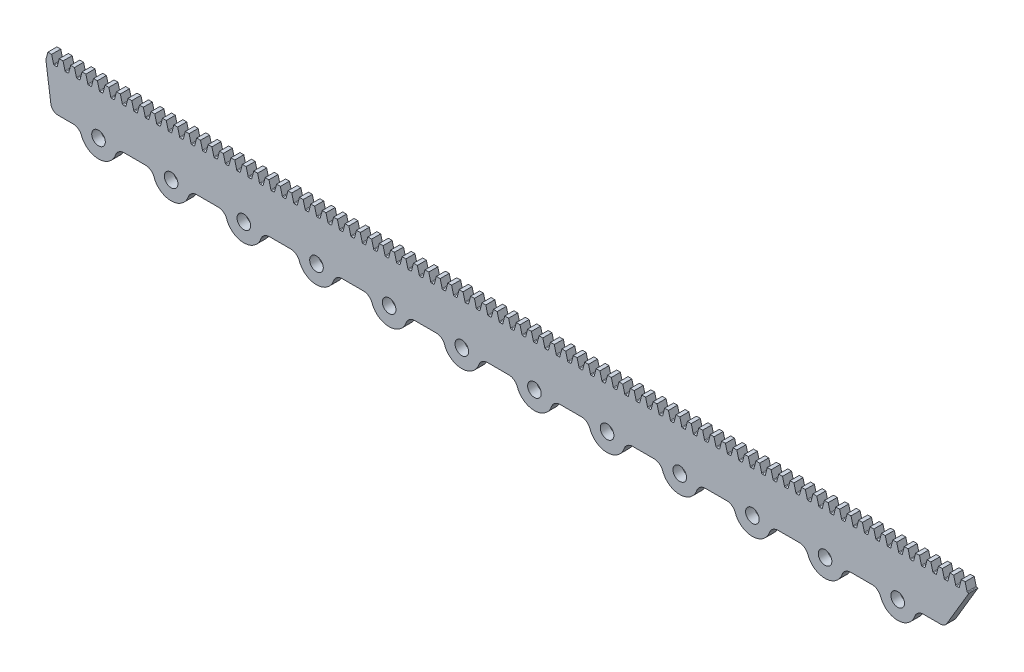
from build123d import *

# Parameters (mm, degrees)
SKETCH1_R           = 2.38125
BOSS_EXTRUDE3_DEPTH = 3.175


with BuildPart() as part:
    # Sketch1 → Boss-Extrude3 (new body)
    with BuildSketch(Plane.XY):
        with BuildLine():
            Line((-103.492449052, -0.977438527), (-95.755744081, 12.0777))
            Line((-95.755744081, 12.0777), (-96.149260964, 12.0777))
            ThreePointArc((-96.149260964, 12.0777), (-96.304764153, 12.130864848), (-96.395170465, 12.268103479))
            Line((-96.395170465, 12.268103479), (-97.081644081, 14.9225))
            Line((-97.081644081, 14.9225), (-98.419666752, 14.9225))
            Line((-98.419666752, 14.9225), (-99.106140368, 12.268103479))
            ThreePointArc((-99.106140368, 12.268103479), (-99.19654668, 12.130864848), (-99.352049869, 12.0777))
            Line((-99.352049869, 12.0777), (-100.139083634, 12.0777))
            ThreePointArc((-100.139083634, 12.0777), (-100.294586823, 12.130864848), (-100.384993135, 12.268103479))
            Line((-100.384993135, 12.268103479), (-101.071466751, 14.9225))
            Line((-101.071466751, 14.9225), (-102.409489422, 14.9225))
            Line((-102.409489422, 14.9225), (-103.095963038, 12.268103479))
            ThreePointArc((-103.095963038, 12.268103479), (-103.18636935, 12.130864848), (-103.341872539, 12.0777))
            Line((-103.341872539, 12.0777), (-104.128906304, 12.0777))
            ThreePointArc((-104.128906304, 12.0777), (-104.284409493, 12.130864848), (-104.374815805, 12.268103479))
            Line((-104.374815805, 12.268103479), (-105.061289421, 14.9225))
            Line((-105.061289421, 14.9225), (-106.399312092, 14.9225))
            Line((-106.399312092, 14.9225), (-107.085785708, 12.268103479))
            ThreePointArc((-107.085785708, 12.268103479), (-107.17619202, 12.130864848), (-107.331695209, 12.0777))
            Line((-107.331695209, 12.0777), (-108.118728974, 12.0777))
            ThreePointArc((-108.118728974, 12.0777), (-108.274232164, 12.130864848), (-108.364638475, 12.268103479))
            Line((-108.364638475, 12.268103479), (-109.051112091, 14.9225))
            Line((-109.051112091, 14.9225), (-110.389134762, 14.9225))
            Line((-110.389134762, 14.9225), (-111.075608378, 12.268103479))
            ThreePointArc((-111.075608378, 12.268103479), (-111.16601469, 12.130864848), (-111.321517879, 12.0777))
            Line((-111.321517879, 12.0777), (-112.108551644, 12.0777))
            ThreePointArc((-112.108551644, 12.0777), (-112.264054834, 12.130864848), (-112.354461145, 12.268103479))
            Line((-112.354461145, 12.268103479), (-113.040934761, 14.9225))
            Line((-113.040934761, 14.9225), (-114.378957432, 14.9225))
            Line((-114.378957432, 14.9225), (-115.065431048, 12.268103479))
            ThreePointArc((-115.065431048, 12.268103479), (-115.15583736, 12.130864848), (-115.311340549, 12.0777))
            Line((-115.311340549, 12.0777), (-116.098374315, 12.0777))
            ThreePointArc((-116.098374315, 12.0777), (-116.253877504, 12.130864848), (-116.344283815, 12.268103479))
            Line((-116.344283815, 12.268103479), (-117.030757431, 14.9225))
            Line((-117.030757431, 14.9225), (-118.368780102, 14.9225))
            Line((-118.368780102, 14.9225), (-119.055253718, 12.268103479))
            ThreePointArc((-119.055253718, 12.268103479), (-119.14566003, 12.130864848), (-119.301163219, 12.0777))
            Line((-119.301163219, 12.0777), (-120.088196985, 12.0777))
            ThreePointArc((-120.088196985, 12.0777), (-120.243700174, 12.130864848), (-120.334106485, 12.268103479))
            Line((-120.334106485, 12.268103479), (-121.020580101, 14.9225))
            Line((-121.020580101, 14.9225), (-122.358602772, 14.9225))
            Line((-122.358602772, 14.9225), (-123.045076388, 12.268103479))
            ThreePointArc((-123.045076388, 12.268103479), (-123.1354827, 12.130864848), (-123.290985889, 12.0777))
            Line((-123.290985889, 12.0777), (-124.078019655, 12.0777))
            ThreePointArc((-124.078019655, 12.0777), (-124.233522844, 12.130864848), (-124.323929155, 12.268103479))
            Line((-124.323929155, 12.268103479), (-125.010402771, 14.9225))
            Line((-125.010402771, 14.9225), (-126.348425442, 14.9225))
            Line((-126.348425442, 14.9225), (-127.034899058, 12.268103479))
            ThreePointArc((-127.034899058, 12.268103479), (-127.12530537, 12.130864848), (-127.280808559, 12.0777))
            Line((-127.280808559, 12.0777), (-128.067842325, 12.0777))
            ThreePointArc((-128.067842325, 12.0777), (-128.223345514, 12.130864848), (-128.313751825, 12.268103479))
            Line((-128.313751825, 12.268103479), (-129.000225442, 14.9225))
            Line((-129.000225442, 14.9225), (-130.338248112, 14.9225))
            Line((-130.338248112, 14.9225), (-131.024721728, 12.268103479))
            ThreePointArc((-131.024721728, 12.268103479), (-131.11512804, 12.130864848), (-131.270631229, 12.0777))
            Line((-131.270631229, 12.0777), (-132.057664995, 12.0777))
            ThreePointArc((-132.057664995, 12.0777), (-132.213168184, 12.130864848), (-132.303574495, 12.268103479))
            Line((-132.303574495, 12.268103479), (-132.990048112, 14.9225))
            Line((-132.990048112, 14.9225), (-134.328070782, 14.9225))
            Line((-134.328070782, 14.9225), (-135.014544399, 12.268103479))
            ThreePointArc((-135.014544399, 12.268103479), (-135.10495071, 12.130864848), (-135.260453899, 12.0777))
            Line((-135.260453899, 12.0777), (-136.047487665, 12.0777))
            ThreePointArc((-136.047487665, 12.0777), (-136.202990854, 12.130864848), (-136.293397165, 12.268103479))
            Line((-136.293397165, 12.268103479), (-136.979870782, 14.9225))
            Line((-136.979870782, 14.9225), (-138.317893452, 14.9225))
            Line((-138.317893452, 14.9225), (-139.004367069, 12.268103479))
            ThreePointArc((-139.004367069, 12.268103479), (-139.09477338, 12.130864848), (-139.250276569, 12.0777))
            Line((-139.250276569, 12.0777), (-140.037310335, 12.0777))
            ThreePointArc((-140.037310335, 12.0777), (-140.192813524, 12.130864848), (-140.283219836, 12.268103479))
            Line((-140.283219836, 12.268103479), (-140.969693452, 14.9225))
            Line((-140.969693452, 14.9225), (-142.307716122, 14.9225))
            Line((-142.307716122, 14.9225), (-142.994189739, 12.268103479))
            ThreePointArc((-142.994189739, 12.268103479), (-143.08459605, 12.130864848), (-143.240099239, 12.0777))
            Line((-143.240099239, 12.0777), (-144.027133005, 12.0777))
            ThreePointArc((-144.027133005, 12.0777), (-144.182636194, 12.130864848), (-144.273042506, 12.268103479))
            Line((-144.273042506, 12.268103479), (-144.959516122, 14.9225))
            Line((-144.959516122, 14.9225), (-146.297538793, 14.9225))
            Line((-146.297538793, 14.9225), (-146.984012409, 12.268103479))
            ThreePointArc((-146.984012409, 12.268103479), (-147.07441872, 12.130864848), (-147.229921909, 12.0777))
            Line((-147.229921909, 12.0777), (-148.016955675, 12.0777))
            ThreePointArc((-148.016955675, 12.0777), (-148.172458864, 12.130864848), (-148.262865176, 12.268103479))
            Line((-148.262865176, 12.268103479), (-148.949338792, 14.9225))
            Line((-148.949338792, 14.9225), (-150.287361463, 14.9225))
            Line((-150.287361463, 14.9225), (-150.973835079, 12.268103479))
            ThreePointArc((-150.973835079, 12.268103479), (-151.06424139, 12.130864848), (-151.219744579, 12.0777))
            Line((-151.219744579, 12.0777), (-152.006778345, 12.0777))
            ThreePointArc((-152.006778345, 12.0777), (-152.162281534, 12.130864848), (-152.252687846, 12.268103479))
            Line((-152.252687846, 12.268103479), (-152.939161462, 14.9225))
            Line((-152.939161462, 14.9225), (-154.277184133, 14.9225))
            Line((-154.277184133, 14.9225), (-154.963657749, 12.268103479))
            ThreePointArc((-154.963657749, 12.268103479), (-155.05406406, 12.130864848), (-155.20956725, 12.0777))
            Line((-155.20956725, 12.0777), (-155.996601015, 12.0777))
            ThreePointArc((-155.996601015, 12.0777), (-156.152104204, 12.130864848), (-156.242510516, 12.268103479))
            Line((-156.242510516, 12.268103479), (-156.928984132, 14.9225))
            Line((-156.928984132, 14.9225), (-158.267006803, 14.9225))
            Line((-158.267006803, 14.9225), (-158.953480419, 12.268103479))
            ThreePointArc((-158.953480419, 12.268103479), (-159.04388673, 12.130864848), (-159.19938992, 12.0777))
            Line((-159.19938992, 12.0777), (-159.986423685, 12.0777))
            ThreePointArc((-159.986423685, 12.0777), (-160.141926874, 12.130864848), (-160.232333186, 12.268103479))
            Line((-160.232333186, 12.268103479), (-160.918806802, 14.9225))
            Line((-160.918806802, 14.9225), (-162.256829473, 14.9225))
            Line((-162.256829473, 14.9225), (-162.943303089, 12.268103479))
            ThreePointArc((-162.943303089, 12.268103479), (-163.0337094, 12.130864848), (-163.18921259, 12.0777))
            Line((-163.18921259, 12.0777), (-163.976246355, 12.0777))
            ThreePointArc((-163.976246355, 12.0777), (-164.131749544, 12.130864848), (-164.222155856, 12.268103479))
            Line((-164.222155856, 12.268103479), (-164.908629472, 14.9225))
            Line((-164.908629472, 14.9225), (-166.246652143, 14.9225))
            Line((-166.246652143, 14.9225), (-166.933125759, 12.268103479))
            ThreePointArc((-166.933125759, 12.268103479), (-167.023532071, 12.130864848), (-167.17903526, 12.0777))
            Line((-167.17903526, 12.0777), (-167.966069025, 12.0777))
            ThreePointArc((-167.966069025, 12.0777), (-168.121572214, 12.130864848), (-168.211978526, 12.268103479))
            Line((-168.211978526, 12.268103479), (-168.898452142, 14.9225))
            Line((-168.898452142, 14.9225), (-170.236474813, 14.9225))
            Line((-170.236474813, 14.9225), (-170.922948429, 12.268103479))
            ThreePointArc((-170.922948429, 12.268103479), (-171.013354741, 12.130864848), (-171.16885793, 12.0777))
            Line((-171.16885793, 12.0777), (-171.955891695, 12.0777))
            ThreePointArc((-171.955891695, 12.0777), (-172.111394884, 12.130864848), (-172.201801196, 12.268103479))
            Line((-172.201801196, 12.268103479), (-172.888274812, 14.9225))
            Line((-172.888274812, 14.9225), (-174.226297483, 14.9225))
            Line((-174.226297483, 14.9225), (-174.912771099, 12.268103479))
            ThreePointArc((-174.912771099, 12.268103479), (-175.003177411, 12.130864848), (-175.1586806, 12.0777))
            Line((-175.1586806, 12.0777), (-175.945714365, 12.0777))
            ThreePointArc((-175.945714365, 12.0777), (-176.101217555, 12.130864848), (-176.191623866, 12.268103479))
            Line((-176.191623866, 12.268103479), (-176.878097482, 14.9225))
            Line((-176.878097482, 14.9225), (-178.216120153, 14.9225))
            Line((-178.216120153, 14.9225), (-178.902593769, 12.268103479))
            ThreePointArc((-178.902593769, 12.268103479), (-178.993000081, 12.130864848), (-179.14850327, 12.0777))
            Line((-179.14850327, 12.0777), (-179.935537035, 12.0777))
            ThreePointArc((-179.935537035, 12.0777), (-180.091040225, 12.130864848), (-180.181446536, 12.268103479))
            Line((-180.181446536, 12.268103479), (-180.867920152, 14.9225))
            Line((-180.867920152, 14.9225), (-182.205942823, 14.9225))
            Line((-182.205942823, 14.9225), (-182.892416439, 12.268103479))
            ThreePointArc((-182.892416439, 12.268103479), (-182.982822751, 12.130864848), (-183.13832594, 12.0777))
            Line((-183.13832594, 12.0777), (-183.925359706, 12.0777))
            ThreePointArc((-183.925359706, 12.0777), (-184.080862895, 12.130864848), (-184.171269206, 12.268103479))
            Line((-184.171269206, 12.268103479), (-184.857742822, 14.9225))
            Line((-184.857742822, 14.9225), (-186.195765493, 14.9225))
            Line((-186.195765493, 14.9225), (-186.882239109, 12.268103479))
            ThreePointArc((-186.882239109, 12.268103479), (-186.972645421, 12.130864848), (-187.12814861, 12.0777))
            Line((-187.12814861, 12.0777), (-187.915182376, 12.0777))
            ThreePointArc((-187.915182376, 12.0777), (-188.070685565, 12.130864848), (-188.161091876, 12.268103479))
            Line((-188.161091876, 12.268103479), (-188.847565492, 14.9225))
            Line((-188.847565492, 14.9225), (-190.185588163, 14.9225))
            Line((-190.185588163, 14.9225), (-190.872061779, 12.268103479))
            ThreePointArc((-190.872061779, 12.268103479), (-190.962468091, 12.130864848), (-191.11797128, 12.0777))
            Line((-191.11797128, 12.0777), (-191.905005046, 12.0777))
            ThreePointArc((-191.905005046, 12.0777), (-192.060508235, 12.130864848), (-192.150914546, 12.268103479))
            Line((-192.150914546, 12.268103479), (-192.837388162, 14.9225))
            Line((-192.837388162, 14.9225), (-194.175410833, 14.9225))
            Line((-194.175410833, 14.9225), (-194.861884449, 12.268103479))
            ThreePointArc((-194.861884449, 12.268103479), (-194.952290761, 12.130864848), (-195.10779395, 12.0777))
            Line((-195.10779395, 12.0777), (-195.894827716, 12.0777))
            ThreePointArc((-195.894827716, 12.0777), (-196.050330905, 12.130864848), (-196.140737216, 12.268103479))
            Line((-196.140737216, 12.268103479), (-196.827210833, 14.9225))
            Line((-196.827210833, 14.9225), (-198.165233503, 14.9225))
            Line((-198.165233503, 14.9225), (-198.851707119, 12.268103479))
            ThreePointArc((-198.851707119, 12.268103479), (-198.942113431, 12.130864848), (-199.09761662, 12.0777))
            Line((-199.09761662, 12.0777), (-199.884650386, 12.0777))
            ThreePointArc((-199.884650386, 12.0777), (-200.040153575, 12.130864848), (-200.130559886, 12.268103479))
            Line((-200.130559886, 12.268103479), (-200.817033503, 14.9225))
            Line((-200.817033503, 14.9225), (-202.155056173, 14.9225))
            Line((-202.155056173, 14.9225), (-202.84152979, 12.268103479))
            ThreePointArc((-202.84152979, 12.268103479), (-202.931936101, 12.130864848), (-203.08743929, 12.0777))
            Line((-203.08743929, 12.0777), (-203.874473056, 12.0777))
            ThreePointArc((-203.874473056, 12.0777), (-204.029976245, 12.130864848), (-204.120382556, 12.268103479))
            Line((-204.120382556, 12.268103479), (-204.806856173, 14.9225))
            Line((-204.806856173, 14.9225), (-206.144878843, 14.9225))
            Line((-206.144878843, 14.9225), (-206.83135246, 12.268103479))
            ThreePointArc((-206.83135246, 12.268103479), (-206.921758771, 12.130864848), (-207.07726196, 12.0777))
            Line((-207.07726196, 12.0777), (-207.864295726, 12.0777))
            ThreePointArc((-207.864295726, 12.0777), (-208.019798915, 12.130864848), (-208.110205227, 12.268103479))
            Line((-208.110205227, 12.268103479), (-208.796678843, 14.9225))
            Line((-208.796678843, 14.9225), (-210.134701513, 14.9225))
            Line((-210.134701513, 14.9225), (-210.82117513, 12.268103479))
            ThreePointArc((-210.82117513, 12.268103479), (-210.911581441, 12.130864848), (-211.06708463, 12.0777))
            Line((-211.06708463, 12.0777), (-211.854118396, 12.0777))
            ThreePointArc((-211.854118396, 12.0777), (-212.009621585, 12.130864848), (-212.100027897, 12.268103479))
            Line((-212.100027897, 12.268103479), (-212.786501513, 14.9225))
            Line((-212.786501513, 14.9225), (-214.124524184, 14.9225))
            Line((-214.124524184, 14.9225), (-214.8109978, 12.268103479))
            ThreePointArc((-214.8109978, 12.268103479), (-214.901404111, 12.130864848), (-215.0569073, 12.0777))
            Line((-215.0569073, 12.0777), (-215.843941066, 12.0777))
            ThreePointArc((-215.843941066, 12.0777), (-215.999444255, 12.130864848), (-216.089850567, 12.268103479))
            Line((-216.089850567, 12.268103479), (-216.776324183, 14.9225))
            Line((-216.776324183, 14.9225), (-218.114346854, 14.9225))
            Line((-218.114346854, 14.9225), (-218.80082047, 12.268103479))
            ThreePointArc((-218.80082047, 12.268103479), (-218.891226781, 12.130864848), (-219.04672997, 12.0777))
            Line((-219.04672997, 12.0777), (-219.833763736, 12.0777))
            ThreePointArc((-219.833763736, 12.0777), (-219.989266925, 12.130864848), (-220.079673237, 12.268103479))
            Line((-220.079673237, 12.268103479), (-220.766146853, 14.9225))
            Line((-220.766146853, 14.9225), (-222.104169524, 14.9225))
            Line((-222.104169524, 14.9225), (-222.79064314, 12.268103479))
            ThreePointArc((-222.79064314, 12.268103479), (-222.881049451, 12.130864848), (-223.036552641, 12.0777))
            Line((-223.036552641, 12.0777), (-223.823586406, 12.0777))
            ThreePointArc((-223.823586406, 12.0777), (-223.979089595, 12.130864848), (-224.069495907, 12.268103479))
            Line((-224.069495907, 12.268103479), (-224.755969523, 14.9225))
            Line((-224.755969523, 14.9225), (-226.093992194, 14.9225))
            Line((-226.093992194, 14.9225), (-226.78046581, 12.268103479))
            ThreePointArc((-226.78046581, 12.268103479), (-226.870872121, 12.130864848), (-227.026375311, 12.0777))
            Line((-227.026375311, 12.0777), (-227.813409076, 12.0777))
            ThreePointArc((-227.813409076, 12.0777), (-227.968912265, 12.130864848), (-228.059318577, 12.268103479))
            Line((-228.059318577, 12.268103479), (-228.745792193, 14.9225))
            Line((-228.745792193, 14.9225), (-230.083814864, 14.9225))
            Line((-230.083814864, 14.9225), (-230.77028848, 12.268103479))
            ThreePointArc((-230.77028848, 12.268103479), (-230.860694791, 12.130864848), (-231.016197981, 12.0777))
            Line((-231.016197981, 12.0777), (-231.803231746, 12.0777))
            ThreePointArc((-231.803231746, 12.0777), (-231.958734935, 12.130864848), (-232.049141247, 12.268103479))
            Line((-232.049141247, 12.268103479), (-232.735614863, 14.9225))
            Line((-232.735614863, 14.9225), (-234.073637534, 14.9225))
            Line((-234.073637534, 14.9225), (-234.76011115, 12.268103479))
            ThreePointArc((-234.76011115, 12.268103479), (-234.850517462, 12.130864848), (-235.006020651, 12.0777))
            Line((-235.006020651, 12.0777), (-235.793054416, 12.0777))
            ThreePointArc((-235.793054416, 12.0777), (-235.948557605, 12.130864848), (-236.038963917, 12.268103479))
            Line((-236.038963917, 12.268103479), (-236.725437533, 14.9225))
            Line((-236.725437533, 14.9225), (-238.063460204, 14.9225))
            Line((-238.063460204, 14.9225), (-238.74993382, 12.268103479))
            ThreePointArc((-238.74993382, 12.268103479), (-238.840340132, 12.130864848), (-238.995843321, 12.0777))
            Line((-238.995843321, 12.0777), (-239.782877086, 12.0777))
            ThreePointArc((-239.782877086, 12.0777), (-239.938380275, 12.130864848), (-240.028786587, 12.268103479))
            Line((-240.028786587, 12.268103479), (-240.715260203, 14.9225))
            Line((-240.715260203, 14.9225), (-242.053282874, 14.9225))
            Line((-242.053282874, 14.9225), (-242.73975649, 12.268103479))
            ThreePointArc((-242.73975649, 12.268103479), (-242.830162802, 12.130864848), (-242.985665991, 12.0777))
            Line((-242.985665991, 12.0777), (-243.772699756, 12.0777))
            ThreePointArc((-243.772699756, 12.0777), (-243.928202946, 12.130864848), (-244.018609257, 12.268103479))
            Line((-244.018609257, 12.268103479), (-244.705082873, 14.9225))
            Line((-244.705082873, 14.9225), (-246.043105544, 14.9225))
            Line((-246.043105544, 14.9225), (-246.72957916, 12.268103479))
            ThreePointArc((-246.72957916, 12.268103479), (-246.819985472, 12.130864848), (-246.975488661, 12.0777))
            Line((-246.975488661, 12.0777), (-247.762522426, 12.0777))
            ThreePointArc((-247.762522426, 12.0777), (-247.918025616, 12.130864848), (-248.008431927, 12.268103479))
            Line((-248.008431927, 12.268103479), (-248.694905543, 14.9225))
            Line((-248.694905543, 14.9225), (-250.032928214, 14.9225))
            Line((-250.032928214, 14.9225), (-250.71940183, 12.268103479))
            ThreePointArc((-250.71940183, 12.268103479), (-250.809808142, 12.130864848), (-250.965311331, 12.0777))
            Line((-250.965311331, 12.0777), (-251.752345097, 12.0777))
            ThreePointArc((-251.752345097, 12.0777), (-251.907848286, 12.130864848), (-251.998254597, 12.268103479))
            Line((-251.998254597, 12.268103479), (-252.684728213, 14.9225))
            Line((-252.684728213, 14.9225), (-254.022750884, 14.9225))
            Line((-254.022750884, 14.9225), (-254.7092245, 12.268103479))
            ThreePointArc((-254.7092245, 12.268103479), (-254.799630812, 12.130864848), (-254.955134001, 12.0777))
            Line((-254.955134001, 12.0777), (-255.742167767, 12.0777))
            ThreePointArc((-255.742167767, 12.0777), (-255.897670956, 12.130864848), (-255.988077267, 12.268103479))
            Line((-255.988077267, 12.268103479), (-256.674550883, 14.9225))
            Line((-256.674550883, 14.9225), (-258.012573554, 14.9225))
            Line((-258.012573554, 14.9225), (-258.69904717, 12.268103479))
            ThreePointArc((-258.69904717, 12.268103479), (-258.789453482, 12.130864848), (-258.944956671, 12.0777))
            Line((-258.944956671, 12.0777), (-259.731990437, 12.0777))
            ThreePointArc((-259.731990437, 12.0777), (-259.887493626, 12.130864848), (-259.977899937, 12.268103479))
            Line((-259.977899937, 12.268103479), (-260.664373553, 14.9225))
            Line((-260.664373553, 14.9225), (-262.002396224, 14.9225))
            Line((-262.002396224, 14.9225), (-262.68886984, 12.268103479))
            ThreePointArc((-262.68886984, 12.268103479), (-262.779276152, 12.130864848), (-262.934779341, 12.0777))
            Line((-262.934779341, 12.0777), (-263.721813107, 12.0777))
            ThreePointArc((-263.721813107, 12.0777), (-263.877316296, 12.130864848), (-263.967722607, 12.268103479))
            Line((-263.967722607, 12.268103479), (-264.654196224, 14.9225))
            Line((-264.654196224, 14.9225), (-265.992218894, 14.9225))
            Line((-265.992218894, 14.9225), (-266.67869251, 12.268103479))
            ThreePointArc((-266.67869251, 12.268103479), (-266.769098822, 12.130864848), (-266.924602011, 12.0777))
            Line((-266.924602011, 12.0777), (-267.711635777, 12.0777))
            ThreePointArc((-267.711635777, 12.0777), (-267.867138966, 12.130864848), (-267.957545277, 12.268103479))
            Line((-267.957545277, 12.268103479), (-268.644018894, 14.9225))
            Line((-268.644018894, 14.9225), (-269.982041564, 14.9225))
            Line((-269.982041564, 14.9225), (-270.668515181, 12.268103479))
            ThreePointArc((-270.668515181, 12.268103479), (-270.758921492, 12.130864848), (-270.914424681, 12.0777))
            Line((-270.914424681, 12.0777), (-271.701458447, 12.0777))
            ThreePointArc((-271.701458447, 12.0777), (-271.856961636, 12.130864848), (-271.947367947, 12.268103479))
            Line((-271.947367947, 12.268103479), (-272.633841564, 14.9225))
            Line((-272.633841564, 14.9225), (-273.971864234, 14.9225))
            Line((-273.971864234, 14.9225), (-274.658337851, 12.268103479))
            ThreePointArc((-274.658337851, 12.268103479), (-274.748744162, 12.130864848), (-274.904247351, 12.0777))
            Line((-274.904247351, 12.0777), (-275.691281117, 12.0777))
            ThreePointArc((-275.691281117, 12.0777), (-275.846784306, 12.130864848), (-275.937190618, 12.268103479))
            Line((-275.937190618, 12.268103479), (-276.623664234, 14.9225))
            Line((-276.623664234, 14.9225), (-277.961686904, 14.9225))
            Line((-277.961686904, 14.9225), (-278.648160521, 12.268103479))
            ThreePointArc((-278.648160521, 12.268103479), (-278.738566832, 12.130864848), (-278.894070021, 12.0777))
            Line((-278.894070021, 12.0777), (-279.681103787, 12.0777))
            ThreePointArc((-279.681103787, 12.0777), (-279.836606976, 12.130864848), (-279.927013288, 12.268103479))
            Line((-279.927013288, 12.268103479), (-280.613486904, 14.9225))
            Line((-280.613486904, 14.9225), (-281.951509575, 14.9225))
            Line((-281.951509575, 14.9225), (-282.637983191, 12.268103479))
            ThreePointArc((-282.637983191, 12.268103479), (-282.728389502, 12.130864848), (-282.883892691, 12.0777))
            Line((-282.883892691, 12.0777), (-283.670926457, 12.0777))
            ThreePointArc((-283.670926457, 12.0777), (-283.826429646, 12.130864848), (-283.916835958, 12.268103479))
            Line((-283.916835958, 12.268103479), (-284.603309574, 14.9225))
            Line((-284.603309574, 14.9225), (-285.941332245, 14.9225))
            Line((-285.941332245, 14.9225), (-286.627805861, 12.268103479))
            ThreePointArc((-286.627805861, 12.268103479), (-286.718212172, 12.130864848), (-286.873715361, 12.0777))
            Line((-286.873715361, 12.0777), (-287.660749127, 12.0777))
            ThreePointArc((-287.660749127, 12.0777), (-287.816252316, 12.130864848), (-287.906658628, 12.268103479))
            Line((-287.906658628, 12.268103479), (-288.593132244, 14.9225))
            Line((-288.593132244, 14.9225), (-289.931154915, 14.9225))
            Line((-289.931154915, 14.9225), (-290.617628531, 12.268103479))
            ThreePointArc((-290.617628531, 12.268103479), (-290.708034842, 12.130864848), (-290.863538032, 12.0777))
            Line((-290.863538032, 12.0777), (-291.650571797, 12.0777))
            ThreePointArc((-291.650571797, 12.0777), (-291.806074986, 12.130864848), (-291.896481298, 12.268103479))
            Line((-291.896481298, 12.268103479), (-292.582954914, 14.9225))
            Line((-292.582954914, 14.9225), (-293.920977585, 14.9225))
            Line((-293.920977585, 14.9225), (-294.607451201, 12.268103479))
            ThreePointArc((-294.607451201, 12.268103479), (-294.697857512, 12.130864848), (-294.853360702, 12.0777))
            Line((-294.853360702, 12.0777), (-295.640394467, 12.0777))
            ThreePointArc((-295.640394467, 12.0777), (-295.795897656, 12.130864848), (-295.886303968, 12.268103479))
            Line((-295.886303968, 12.268103479), (-296.572777584, 14.9225))
            Line((-296.572777584, 14.9225), (-297.910800255, 14.9225))
            Line((-297.910800255, 14.9225), (-298.597273871, 12.268103479))
            ThreePointArc((-298.597273871, 12.268103479), (-298.687680182, 12.130864848), (-298.843183372, 12.0777))
            Line((-298.843183372, 12.0777), (-299.630217137, 12.0777))
            ThreePointArc((-299.630217137, 12.0777), (-299.785720326, 12.130864848), (-299.876126638, 12.268103479))
            Line((-299.876126638, 12.268103479), (-300.562600254, 14.9225))
            Line((-300.562600254, 14.9225), (-301.900622925, 14.9225))
            Line((-301.900622925, 14.9225), (-302.587096541, 12.268103479))
            ThreePointArc((-302.587096541, 12.268103479), (-302.677502853, 12.130864848), (-302.833006042, 12.0777))
            Line((-302.833006042, 12.0777), (-303.620039807, 12.0777))
            ThreePointArc((-303.620039807, 12.0777), (-303.775542996, 12.130864848), (-303.865949308, 12.268103479))
            Line((-303.865949308, 12.268103479), (-304.552422924, 14.9225))
            Line((-304.552422924, 14.9225), (-305.890445595, 14.9225))
            Line((-305.890445595, 14.9225), (-306.576919211, 12.268103479))
            ThreePointArc((-306.576919211, 12.268103479), (-306.667325523, 12.130864848), (-306.822828712, 12.0777))
            Line((-306.822828712, 12.0777), (-307.609862477, 12.0777))
            ThreePointArc((-307.609862477, 12.0777), (-307.765365666, 12.130864848), (-307.855771978, 12.268103479))
            Line((-307.855771978, 12.268103479), (-308.542245594, 14.9225))
            Line((-308.542245594, 14.9225), (-309.880268265, 14.9225))
            Line((-309.880268265, 14.9225), (-310.566741881, 12.268103479))
            ThreePointArc((-310.566741881, 12.268103479), (-310.657148193, 12.130864848), (-310.812651382, 12.0777))
            Line((-310.812651382, 12.0777), (-311.599685147, 12.0777))
            ThreePointArc((-311.599685147, 12.0777), (-311.755188337, 12.130864848), (-311.845594648, 12.268103479))
            Line((-311.845594648, 12.268103479), (-312.532068264, 14.9225))
            Line((-312.532068264, 14.9225), (-313.870090935, 14.9225))
            Line((-313.870090935, 14.9225), (-314.556564551, 12.268103479))
            ThreePointArc((-314.556564551, 12.268103479), (-314.646970863, 12.130864848), (-314.802474052, 12.0777))
            Line((-314.802474052, 12.0777), (-315.589507817, 12.0777))
            ThreePointArc((-315.589507817, 12.0777), (-315.745011007, 12.130864848), (-315.835417318, 12.268103479))
            Line((-315.835417318, 12.268103479), (-316.521890934, 14.9225))
            Line((-316.521890934, 14.9225), (-317.859913605, 14.9225))
            Line((-317.859913605, 14.9225), (-318.546387221, 12.268103479))
            ThreePointArc((-318.546387221, 12.268103479), (-318.636793533, 12.130864848), (-318.792296722, 12.0777))
            Line((-318.792296722, 12.0777), (-319.579330488, 12.0777))
            ThreePointArc((-319.579330488, 12.0777), (-319.734833677, 12.130864848), (-319.825239988, 12.268103479))
            Line((-319.825239988, 12.268103479), (-320.511713604, 14.9225))
            Line((-320.511713604, 14.9225), (-321.849736275, 14.9225))
            Line((-321.849736275, 14.9225), (-322.536209891, 12.268103479))
            ThreePointArc((-322.536209891, 12.268103479), (-322.626616203, 12.130864848), (-322.782119392, 12.0777))
            Line((-322.782119392, 12.0777), (-323.569153158, 12.0777))
            ThreePointArc((-323.569153158, 12.0777), (-323.724656347, 12.130864848), (-323.815062658, 12.268103479))
            Line((-323.815062658, 12.268103479), (-324.501536274, 14.9225))
            Line((-324.501536274, 14.9225), (-325.839558945, 14.9225))
            Line((-325.839558945, 14.9225), (-326.526032561, 12.268103479))
            ThreePointArc((-326.526032561, 12.268103479), (-326.616438873, 12.130864848), (-326.771942062, 12.0777))
            Line((-326.771942062, 12.0777), (-327.558975828, 12.0777))
            ThreePointArc((-327.558975828, 12.0777), (-327.714479017, 12.130864848), (-327.804885328, 12.268103479))
            Line((-327.804885328, 12.268103479), (-328.491358944, 14.9225))
            Line((-328.491358944, 14.9225), (-329.829381615, 14.9225))
            Line((-329.829381615, 14.9225), (-330.515855231, 12.268103479))
            ThreePointArc((-330.515855231, 12.268103479), (-330.606261543, 12.130864848), (-330.761764732, 12.0777))
            Line((-330.761764732, 12.0777), (-331.548798498, 12.0777))
            ThreePointArc((-331.548798498, 12.0777), (-331.704301687, 12.130864848), (-331.794707998, 12.268103479))
            Line((-331.794707998, 12.268103479), (-332.481181615, 14.9225))
            Line((-332.481181615, 14.9225), (-333.819204285, 14.9225))
            Line((-333.819204285, 14.9225), (-334.505677902, 12.268103479))
            ThreePointArc((-334.505677902, 12.268103479), (-334.596084213, 12.130864848), (-334.751587402, 12.0777))
            Line((-334.751587402, 12.0777), (-335.538621168, 12.0777))
            ThreePointArc((-335.538621168, 12.0777), (-335.694124357, 12.130864848), (-335.784530668, 12.268103479))
            Line((-335.784530668, 12.268103479), (-336.471004285, 14.9225))
            Line((-336.471004285, 14.9225), (-337.809026955, 14.9225))
            Line((-337.809026955, 14.9225), (-338.495500572, 12.268103479))
            ThreePointArc((-338.495500572, 12.268103479), (-338.585906883, 12.130864848), (-338.741410072, 12.0777))
            Line((-338.741410072, 12.0777), (-339.528443838, 12.0777))
            ThreePointArc((-339.528443838, 12.0777), (-339.683947027, 12.130864848), (-339.774353338, 12.268103479))
            Line((-339.774353338, 12.268103479), (-340.460826955, 14.9225))
            Line((-340.460826955, 14.9225), (-341.798849625, 14.9225))
            Line((-341.798849625, 14.9225), (-342.485323242, 12.268103479))
            ThreePointArc((-342.485323242, 12.268103479), (-342.575729553, 12.130864848), (-342.731232742, 12.0777))
            Line((-342.731232742, 12.0777), (-343.518266508, 12.0777))
            ThreePointArc((-343.518266508, 12.0777), (-343.673769697, 12.130864848), (-343.764176009, 12.268103479))
            Line((-343.764176009, 12.268103479), (-344.450649625, 14.9225))
            Line((-344.450649625, 14.9225), (-345.788672295, 14.9225))
            Line((-345.788672295, 14.9225), (-346.475145912, 12.268103479))
            ThreePointArc((-346.475145912, 12.268103479), (-346.565552223, 12.130864848), (-346.721055412, 12.0777))
            Line((-346.721055412, 12.0777), (-347.508089178, 12.0777))
            ThreePointArc((-347.508089178, 12.0777), (-347.663592367, 12.130864848), (-347.753998679, 12.268103479))
            Line((-347.753998679, 12.268103479), (-348.440472295, 14.9225))
            Line((-348.440472295, 14.9225), (-349.778494966, 14.9225))
            Line((-349.778494966, 14.9225), (-350.464968582, 12.268103479))
            ThreePointArc((-350.464968582, 12.268103479), (-350.555374893, 12.130864848), (-350.710878082, 12.0777))
            Line((-350.710878082, 12.0777), (-351.497911848, 12.0777))
            ThreePointArc((-351.497911848, 12.0777), (-351.653415037, 12.130864848), (-351.743821349, 12.268103479))
            Line((-351.743821349, 12.268103479), (-352.430294965, 14.9225))
            Line((-352.430294965, 14.9225), (-353.768317636, 14.9225))
            Line((-353.768317636, 14.9225), (-354.454791252, 12.268103479))
            ThreePointArc((-354.454791252, 12.268103479), (-354.545197563, 12.130864848), (-354.700700752, 12.0777))
            Line((-354.700700752, 12.0777), (-355.487734518, 12.0777))
            ThreePointArc((-355.487734518, 12.0777), (-355.643237707, 12.130864848), (-355.733644019, 12.268103479))
            Line((-355.733644019, 12.268103479), (-356.420117635, 14.9225))
            Line((-356.420117635, 14.9225), (-357.758140306, 14.9225))
            Line((-357.758140306, 14.9225), (-358.444613922, 12.268103479))
            ThreePointArc((-358.444613922, 12.268103479), (-358.535020233, 12.130864848), (-358.690523423, 12.0777))
            Line((-358.690523423, 12.0777), (-359.477557188, 12.0777))
            ThreePointArc((-359.477557188, 12.0777), (-359.633060377, 12.130864848), (-359.723466689, 12.268103479))
            Line((-359.723466689, 12.268103479), (-360.409940305, 14.9225))
            Line((-360.409940305, 14.9225), (-361.747962976, 14.9225))
            Line((-361.747962976, 14.9225), (-362.434436592, 12.268103479))
            ThreePointArc((-362.434436592, 12.268103479), (-362.524842903, 12.130864848), (-362.680346093, 12.0777))
            Line((-362.680346093, 12.0777), (-363.467379858, 12.0777))
            ThreePointArc((-363.467379858, 12.0777), (-363.622883047, 12.130864848), (-363.713289359, 12.268103479))
            Line((-363.713289359, 12.268103479), (-364.399762975, 14.9225))
            Line((-364.399762975, 14.9225), (-365.737785646, 14.9225))
            Line((-365.737785646, 14.9225), (-366.424259262, 12.268103479))
            ThreePointArc((-366.424259262, 12.268103479), (-366.514665574, 12.130864848), (-366.670168763, 12.0777))
            Line((-366.670168763, 12.0777), (-367.457202528, 12.0777))
            ThreePointArc((-367.457202528, 12.0777), (-367.612705717, 12.130864848), (-367.703112029, 12.268103479))
            Line((-367.703112029, 12.268103479), (-368.389585645, 14.9225))
            Line((-368.389585645, 14.9225), (-369.727608316, 14.9225))
            Line((-369.727608316, 14.9225), (-370.414081932, 12.268103479))
            ThreePointArc((-370.414081932, 12.268103479), (-370.504488244, 12.130864848), (-370.659991433, 12.0777))
            Line((-370.659991433, 12.0777), (-371.447025198, 12.0777))
            ThreePointArc((-371.447025198, 12.0777), (-371.602528387, 12.130864848), (-371.692934699, 12.268103479))
            Line((-371.692934699, 12.268103479), (-372.379408315, 14.9225))
            Line((-372.379408315, 14.9225), (-373.717430986, 14.9225))
            Line((-373.717430986, 14.9225), (-374.403904602, 12.268103479))
            ThreePointArc((-374.403904602, 12.268103479), (-374.494310914, 12.130864848), (-374.649814103, 12.0777))
            Line((-374.649814103, 12.0777), (-375.436847868, 12.0777))
            ThreePointArc((-375.436847868, 12.0777), (-375.592351057, 12.130864848), (-375.682757369, 12.268103479))
            Line((-375.682757369, 12.268103479), (-376.369230985, 14.9225))
            Line((-376.369230985, 14.9225), (-377.707253656, 14.9225))
            Line((-377.707253656, 14.9225), (-378.393727272, 12.268103479))
            ThreePointArc((-378.393727272, 12.268103479), (-378.484133584, 12.130864848), (-378.639636773, 12.0777))
            Line((-378.639636773, 12.0777), (-379.450047868, 12.0777))
            ThreePointArc((-379.450047868, 12.0777), (-379.605551057, 12.130864848), (-379.695957369, 12.268103479))
            Line((-379.695957369, 12.268103479), (-380.382430985, 14.9225))
            Line((-380.382430985, 14.9225), (-381.720453656, 14.9225))
            Line((-381.720453656, 14.9225), (-382.406927272, 12.268103479))
            ThreePointArc((-382.406927272, 12.268103479), (-382.497333584, 12.130864848), (-382.652836773, 12.0777))
            Line((-382.652836773, 12.0777), (-383.463247868, 12.0777))
            ThreePointArc((-383.463247868, 12.0777), (-383.618751057, 12.130864848), (-383.709157369, 12.268103479))
            Line((-383.709157369, 12.268103479), (-384.395630985, 14.9225))
            Line((-384.395630985, 14.9225), (-385.733653656, 14.9225))
            Line((-385.733653656, 14.9225), (-386.420127272, 12.268103479))
            ThreePointArc((-386.420127272, 12.268103479), (-386.510533584, 12.130864848), (-386.666036773, 12.0777))
            Line((-386.666036773, 12.0777), (-387.476447868, 12.0777))
            ThreePointArc((-387.476447868, 12.0777), (-387.631951057, 12.130864848), (-387.722357369, 12.268103479))
            Line((-387.722357369, 12.268103479), (-388.408830985, 14.9225))
            Line((-388.408830985, 14.9225), (-389.746853656, 14.9225))
            Line((-389.746853656, 14.9225), (-390.433327272, 12.268103479))
            ThreePointArc((-390.433327272, 12.268103479), (-390.523733584, 12.130864848), (-390.679236773, 12.0777))
            Line((-390.679236773, 12.0777), (-391.489647868, 12.0777))
            ThreePointArc((-391.489647868, 12.0777), (-391.645151057, 12.130864848), (-391.735557369, 12.268103479))
            Line((-391.735557369, 12.268103479), (-392.422030985, 14.9225))
            Line((-392.422030985, 14.9225), (-393.760053656, 14.9225))
            Line((-393.760053656, 14.9225), (-394.446527272, 12.268103479))
            ThreePointArc((-394.446527272, 12.268103479), (-394.536933584, 12.130864848), (-394.692436773, 12.0777))
            Line((-394.692436773, 12.0777), (-395.502847868, 12.0777))
            ThreePointArc((-395.502847868, 12.0777), (-395.658351057, 12.130864848), (-395.748757369, 12.268103479))
            Line((-395.748757369, 12.268103479), (-396.435230985, 14.9225))
            Line((-396.435230985, 14.9225), (-397.773253656, 14.9225))
            Line((-397.773253656, 14.9225), (-398.459727272, 12.268103479))
            ThreePointArc((-398.459727272, 12.268103479), (-398.550133584, 12.130864848), (-398.705636773, 12.0777))
            Line((-398.705636773, 12.0777), (-399.516047868, 12.0777))
            ThreePointArc((-399.516047868, 12.0777), (-399.671551057, 12.130864848), (-399.761957369, 12.268103479))
            Line((-399.761957369, 12.268103479), (-400.448430985, 14.9225))
            Line((-400.448430985, 14.9225), (-401.786453656, 14.9225))
            Line((-401.786453656, 14.9225), (-402.472927272, 12.268103479))
            ThreePointArc((-402.472927272, 12.268103479), (-402.563333584, 12.130864848), (-402.718836773, 12.0777))
            Line((-402.718836773, 12.0777), (-403.529247868, 12.0777))
            ThreePointArc((-403.529247868, 12.0777), (-403.684751057, 12.130864848), (-403.775157369, 12.268103479))
            Line((-403.775157369, 12.268103479), (-404.461630985, 14.9225))
            Line((-404.461630985, 14.9225), (-405.799653656, 14.9225))
            Line((-405.799653656, 14.9225), (-406.486127272, 12.268103479))
            ThreePointArc((-406.486127272, 12.268103479), (-406.576533584, 12.130864848), (-406.732036773, 12.0777))
            Line((-406.732036773, 12.0777), (-407.510335965, 12.0777))
            ThreePointArc((-407.510335965, 12.0777), (-407.671103216, 12.12817238), (-407.764980039, 12.268103479))
            Line((-407.764980039, 12.268103479), (-408.451453655, 14.9225))
            Line((-408.451453655, 14.9225), (-409.789476326, 14.9225))
            Line((-409.789476326, 14.9225), (-410.475949942, 12.268103479))
            ThreePointArc((-410.475949942, 12.268103479), (-410.566356254, 12.130864848), (-410.721859443, 12.0777))
            Line((-410.721859443, 12.0777), (-411.508893208, 12.0777))
            ThreePointArc((-411.508893208, 12.0777), (-411.664396398, 12.130864848), (-411.754802709, 12.268103479))
            Line((-411.754802709, 12.268103479), (-412.441276325, 14.9225))
            Line((-412.441276325, 14.9225), (-413.779298996, 14.9225))
            Line((-413.779298996, 14.9225), (-414.465772612, 12.268103479))
            ThreePointArc((-414.465772612, 12.268103479), (-414.556178924, 12.130864848), (-414.711682113, 12.0777))
            Line((-414.711682113, 12.0777), (-415.498715879, 12.0777))
            ThreePointArc((-415.498715879, 12.0777), (-415.654219068, 12.130864848), (-415.744625379, 12.268103479))
            Line((-415.744625379, 12.268103479), (-416.431098995, 14.9225))
            Line((-416.431098995, 14.9225), (-417.769121666, 14.9225))
            Line((-417.769121666, 14.9225), (-418.329294794, 12.75647123))
            ThreePointArc((-418.329294794, 12.75647123), (-418.406070763, 12.265276177), (-418.385695025, 11.768534837))
            Line((-418.385695025, 11.768534837), (-416.708906195, -0.215271014))
            ThreePointArc((-416.708906195, -0.215271014), (-415.860383243, -1.77975578), (-414.193410958, -2.403299832))
            Line((-414.193410958, -2.403299832), (-408.963266758, -2.403299832))
            ThreePointArc((-408.963266758, -2.403299832), (-407.130179654, -2.985923188), (-405.969848051, -4.519966499))
            ThreePointArc((-405.969848051, -4.519966499), (-399.953626037, -8.571768043), (-394.063200869, -4.339166667))
            ThreePointArc((-394.063200869, -4.339166667), (-392.902869267, -2.805123356), (-391.069782162, -2.2225))
            Line((-391.069782162, -2.2225), (-383.630294404, -2.2225))
            ThreePointArc((-383.630294404, -2.2225), (-381.7972073, -2.805123356), (-380.636875697, -4.339166667))
            ThreePointArc((-380.636875697, -4.339166667), (-374.650038283, -8.5725), (-368.663200869, -4.339166667))
            ThreePointArc((-368.663200869, -4.339166667), (-367.502869267, -2.805123356), (-365.669782162, -2.2225))
            Line((-365.669782162, -2.2225), (-358.230294404, -2.2225))
            ThreePointArc((-358.230294404, -2.2225), (-356.3972073, -2.805123356), (-355.236875697, -4.339166667))
            ThreePointArc((-355.236875697, -4.339166667), (-349.250038283, -8.5725), (-343.263200869, -4.339166667))
            ThreePointArc((-343.263200869, -4.339166667), (-342.102869267, -2.805123356), (-340.269782162, -2.2225))
            Line((-340.269782162, -2.2225), (-332.830294404, -2.2225))
            ThreePointArc((-332.830294404, -2.2225), (-330.9972073, -2.805123356), (-329.836875697, -4.339166667))
            ThreePointArc((-329.836875697, -4.339166667), (-323.850038283, -8.5725), (-317.863200869, -4.339166667))
            ThreePointArc((-317.863200869, -4.339166667), (-316.702869267, -2.805123356), (-314.869782162, -2.2225))
            Line((-314.869782162, -2.2225), (-307.430294404, -2.2225))
            ThreePointArc((-307.430294404, -2.2225), (-305.5972073, -2.805123356), (-304.436875697, -4.339166667))
            ThreePointArc((-304.436875697, -4.339166667), (-298.450038283, -8.5725), (-292.463200869, -4.339166667))
            ThreePointArc((-292.463200869, -4.339166667), (-291.302869267, -2.805123356), (-289.469782162, -2.2225))
            Line((-289.469782162, -2.2225), (-282.030294404, -2.2225))
            ThreePointArc((-282.030294404, -2.2225), (-280.1972073, -2.805123356), (-279.036875697, -4.339166667))
            ThreePointArc((-279.036875697, -4.339166667), (-273.050038283, -8.5725), (-267.063200869, -4.339166667))
            ThreePointArc((-267.063200869, -4.339166667), (-265.902869267, -2.805123356), (-264.069782162, -2.2225))
            Line((-264.069782162, -2.2225), (-256.630294404, -2.2225))
            ThreePointArc((-256.630294404, -2.2225), (-254.7972073, -2.805123356), (-253.636875697, -4.339166667))
            ThreePointArc((-253.636875697, -4.339166667), (-247.650038283, -8.5725), (-241.663200869, -4.339166667))
            ThreePointArc((-241.663200869, -4.339166667), (-240.502869267, -2.805123356), (-238.669782162, -2.2225))
            Line((-238.669782162, -2.2225), (-231.230294404, -2.2225))
            ThreePointArc((-231.230294404, -2.2225), (-229.3972073, -2.805123356), (-228.236875697, -4.339166667))
            ThreePointArc((-228.236875697, -4.339166667), (-222.250038283, -8.5725), (-216.263200869, -4.339166667))
            ThreePointArc((-216.263200869, -4.339166667), (-215.102869267, -2.805123356), (-213.269782162, -2.2225))
            Line((-213.269782162, -2.2225), (-205.830294404, -2.2225))
            ThreePointArc((-205.830294404, -2.2225), (-203.9972073, -2.805123356), (-202.836875697, -4.339166667))
            ThreePointArc((-202.836875697, -4.339166667), (-196.850038283, -8.5725), (-190.863200869, -4.339166667))
            ThreePointArc((-190.863200869, -4.339166667), (-189.702869267, -2.805123356), (-187.869782162, -2.2225))
            Line((-187.869782162, -2.2225), (-180.430294404, -2.2225))
            ThreePointArc((-180.430294404, -2.2225), (-178.5972073, -2.805123356), (-177.436875697, -4.339166667))
            ThreePointArc((-177.436875697, -4.339166667), (-171.450038283, -8.5725), (-165.463200869, -4.339166667))
            ThreePointArc((-165.463200869, -4.339166667), (-164.302869267, -2.805123356), (-162.469782162, -2.2225))
            Line((-162.469782162, -2.2225), (-155.030294404, -2.2225))
            ThreePointArc((-155.030294404, -2.2225), (-153.1972073, -2.805123356), (-152.036875697, -4.339166667))
            ThreePointArc((-152.036875697, -4.339166667), (-146.050038283, -8.5725), (-140.063200869, -4.339166667))
            ThreePointArc((-140.063200869, -4.339166667), (-138.902869267, -2.805123356), (-137.069782162, -2.2225))
            Line((-137.069782162, -2.2225), (-129.630294404, -2.2225))
            ThreePointArc((-129.630294404, -2.2225), (-127.7972073, -2.805123356), (-126.636875697, -4.339166667))
            ThreePointArc((-126.636875697, -4.339166667), (-120.650038283, -8.5725), (-114.663200869, -4.339166667))
            ThreePointArc((-114.663200869, -4.339166667), (-113.502869267, -2.805123356), (-111.669782162, -2.2225))
            Line((-111.669782162, -2.2225), (-105.677565573, -2.2225))
            ThreePointArc((-105.677565573, -2.2225), (-104.420096659, -1.889391916), (-103.492449052, -0.977438527))
        make_face()
        with Locations((-374.650038283, -2.2225)):
            Circle(SKETCH1_R, mode=Mode.SUBTRACT)
        with Locations((-349.250038283, -2.2225)):
            Circle(SKETCH1_R, mode=Mode.SUBTRACT)
        with Locations((-323.850038283, -2.2225)):
            Circle(SKETCH1_R, mode=Mode.SUBTRACT)
        with Locations((-298.450038283, -2.2225)):
            Circle(SKETCH1_R, mode=Mode.SUBTRACT)
        with Locations((-273.050038283, -2.2225)):
            Circle(SKETCH1_R, mode=Mode.SUBTRACT)
        with Locations((-247.650038283, -2.2225)):
            Circle(SKETCH1_R, mode=Mode.SUBTRACT)
        with Locations((-222.250038283, -2.2225)):
            Circle(SKETCH1_R, mode=Mode.SUBTRACT)
        with Locations((-196.850038283, -2.2225)):
            Circle(SKETCH1_R, mode=Mode.SUBTRACT)
        with Locations((-171.450038283, -2.2225)):
            Circle(SKETCH1_R, mode=Mode.SUBTRACT)
        with Locations((-146.050038283, -2.2225)):
            Circle(SKETCH1_R, mode=Mode.SUBTRACT)
        with Locations((-120.650038283, -2.2225)):
            Circle(SKETCH1_R, mode=Mode.SUBTRACT)
        with Locations((-400.050038283, -2.2225)):
            Circle(SKETCH1_R, mode=Mode.SUBTRACT)
    extrude(amount=BOSS_EXTRUDE3_DEPTH)


solid = part.part
